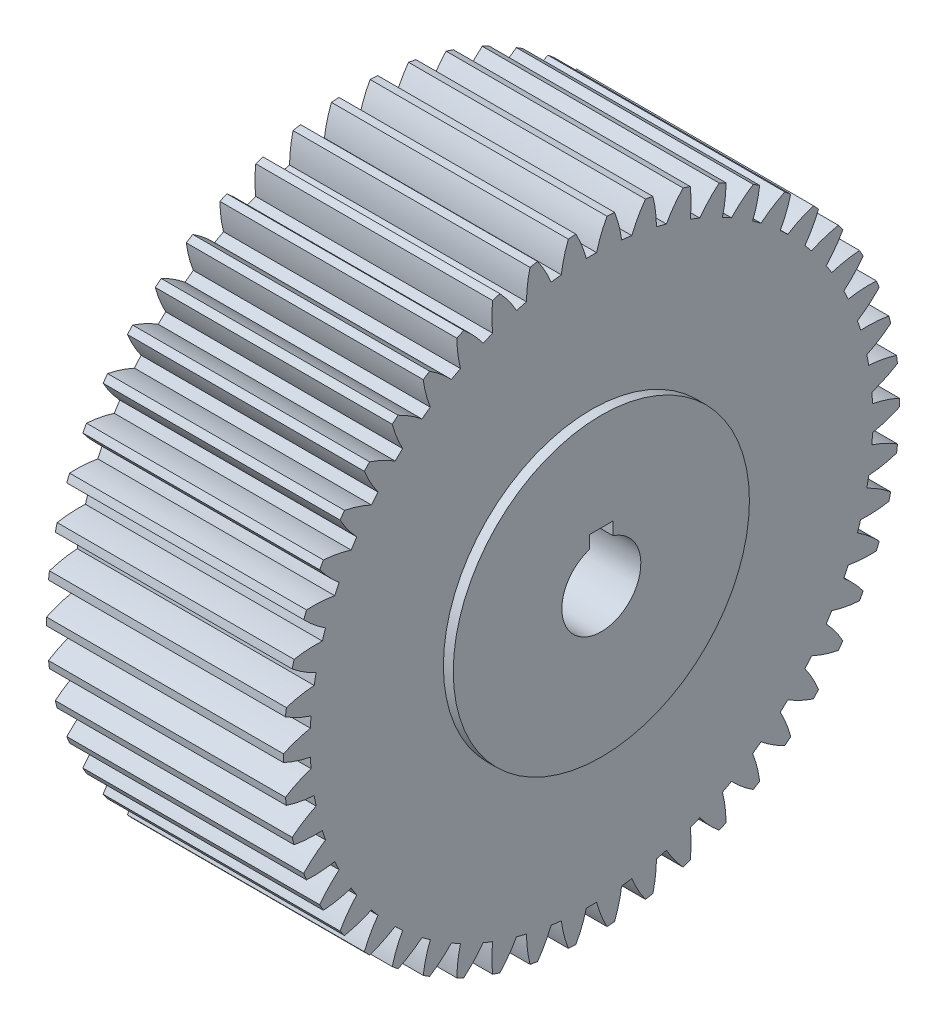
from build123d import *

# Parameters (mm, degrees)
BASPROSKE_W       = 60
BASPROSKE_H       = 78
TOOTHCUT_DEPTH    = 126.570697219
TEETHCUTS_COUNT   = 50
TEETHCUTS_ANGLE   = 352.8
HUBNEABOTSKE_R    = 37.5
HUBNEARBOTH_DEPTH = 2.5000254
HUBFAR_START      = 2.5000254
HUBFARSKE_R       = 37.5
HUBFAR_DEPTH      = 2.5000254
BORSKE_R          = 10
BORE_DEPTH        = 65.0000508
KEYSKE_W          = 6
KEYSKE_H          = 12.8
KEYWAY_DEPTH      = 65.0000508


with BuildPart() as part:
    # BasProSke → Base-Revolve (revolve)
    with BuildSketch(Plane(origin=(0, 0, 0), x_dir=(1, 0, 0), z_dir=(0, 1, 0)), mode=Mode.PRIVATE) as base_revolve_sk:
        with Locations((30, 39)):
            Rectangle(BASPROSKE_W, BASPROSKE_H)
    revolve(base_revolve_sk.sketch.rotate(Axis((-10, 0, 0), (1, 0, 0)), 180), axis=Axis((-10, 0, 0), (1, 0, 0)))

    # TooCutSke → ToothCut (cut, through all)
    with BuildSketch(Plane(origin=(0, 0, 0), x_dir=(0, 0, -1), z_dir=(1, 0, 0))):
        with BuildLine():
            ThreePointArc((1.301872716, 71.237104998), (0, 71.249), (-1.301872716, 71.237104998))
            ThreePointArc((-1.301872716, 71.237104998), (-2.424082412, 74.660875923), (-3.948650849, 77.925420766))
            ThreePointArc((-3.948650849, 77.925420766), (0, 78.0254), (3.948650849, 77.925420766))
            ThreePointArc((3.948650849, 77.925420766), (2.424082412, 74.660875923), (1.301872716, 71.237104998))
        make_face()
    toothcut = extrude(amount=TOOTHCUT_DEPTH, mode=Mode.SUBTRACT)

    # TeethCuts: ToothCut ×50 about axis
    teethcuts_axis = Axis((-10, 0, 0), (1, 0, 0))
    for i in range(1, TEETHCUTS_COUNT):
        add(toothcut.rotate(teethcuts_axis, i * TEETHCUTS_ANGLE / (TEETHCUTS_COUNT - 1)), mode=Mode.SUBTRACT)

    # HubNeaBotSke → HubNearBoth (add)
    with BuildSketch(Plane.ZY):
        with Locations(Location((0, 0, 0), (0, 0, 180))):
            Circle(HUBNEABOTSKE_R)
    extrude(amount=HUBNEARBOTH_DEPTH)

    # HubFarSke → HubFar (add)
    with BuildSketch(Plane(origin=(60, 0, 0), x_dir=(0, 0, -1), z_dir=(1, 0, 0)).offset(HUBFAR_START)):
        Circle(HUBFARSKE_R)
    extrude(amount=-HUBFAR_DEPTH)

    # BorSke → Bore (cut, symmetric)
    with BuildSketch(Plane(origin=(0, 0, 0), x_dir=(0, 0, -1), z_dir=(1, 0, 0))):
        with Locations(Location((0, 0, 0), (0, 0, 180))):
            Circle(BORSKE_R)
    extrude(amount=BORE_DEPTH, both=True, mode=Mode.SUBTRACT)

    # KeySke → Keyway (cut, symmetric)
    with BuildSketch(Plane(origin=(0, 0, 0), x_dir=(0, 0, -1), z_dir=(1, 0, 0))):
        with Locations((0, 6.4)):
            Rectangle(KEYSKE_W, KEYSKE_H)
    extrude(amount=KEYWAY_DEPTH, both=True, mode=Mode.SUBTRACT)


solid = part.part
